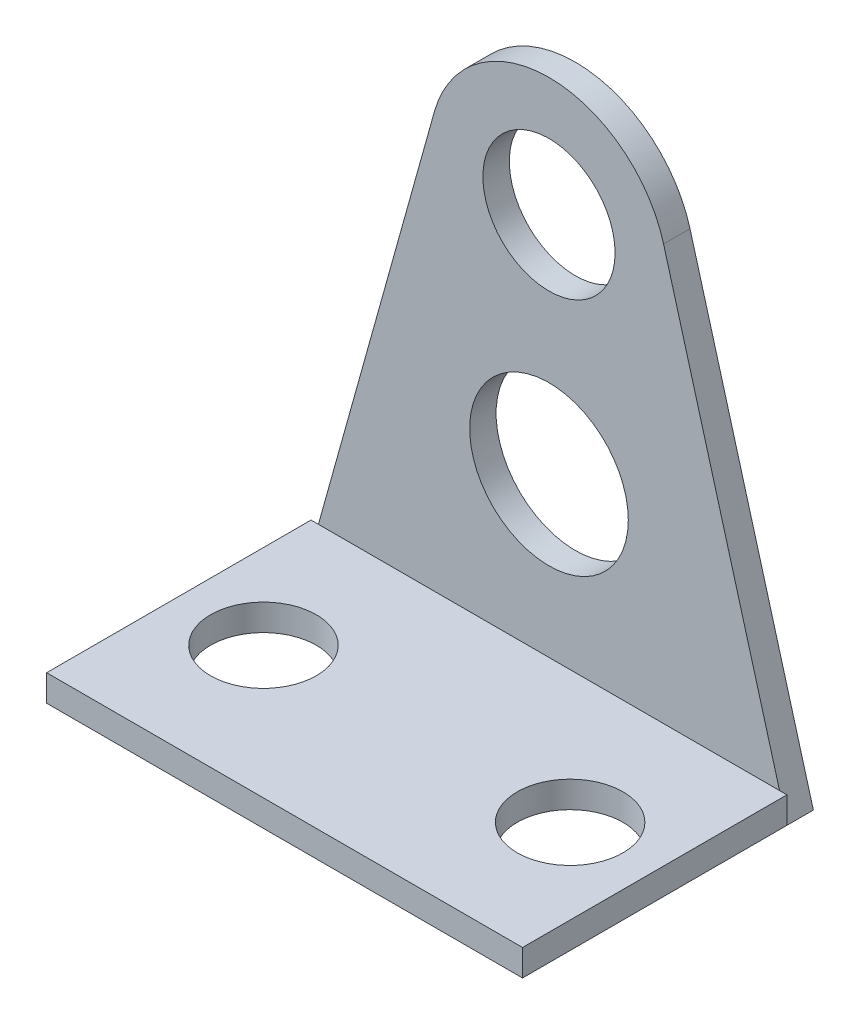
from build123d import *

# Parameters (mm, degrees)
SKETCH_1_R          = 1.25
SKETCH_1_R_2        = 1.5
EXTRUDE_1_DEPTH     = 0.5
SKETCH_2_W          = 9
SKETCH_2_H          = 0.5
EXTRUDE_2_DEPTH     = 5
CUT_EXTRUDE_1_REACH = 16.195
SKETCH_3_R          = 1


with BuildPart() as part:
    # 草图1 → 凸台-拉伸1 (new body)
    with BuildSketch(Plane.XY):
        with BuildLine():
            Line((0, 0), (9, 0))
            Line((9, 0), (6.667108595, 8.355095313))
            ThreePointArc((6.667108595, 8.355095313), (4.5, 10), (2.332891405, 8.355095313))
            Line((2.332891405, 8.355095313), (0, 0))
        make_face()
        with Locations((4.5, 7.75)):
            Circle(SKETCH_1_R, mode=Mode.SUBTRACT)
        with Locations((4.5, 3.5)):
            Circle(SKETCH_1_R_2, mode=Mode.SUBTRACT)
    extrude(amount=EXTRUDE_1_DEPTH)

    # 草图2 → 凸台-拉伸2 (add)
    with BuildSketch(Plane.XY.offset(0.5)):
        with Locations((4.5, 0.25)):
            Rectangle(SKETCH_2_W, SKETCH_2_H)
    extrude(amount=EXTRUDE_2_DEPTH)

    # 草图3 → 切除-拉伸1 (cut, up to next)
    with BuildSketch(Plane(origin=(0, 0.5, 0), x_dir=(1, 0, 0), z_dir=(0, 1, 0)), mode=Mode.PRIVATE) as cut_extrude_1_sk1:
        with Locations(Location((1.6, -3, 0), (0, 0, 270))):
            Circle(SKETCH_3_R)
    cut_extrude_1_tool1 = extrude(cut_extrude_1_sk1.sketch, amount=-CUT_EXTRUDE_1_REACH, mode=Mode.PRIVATE) & part.part
    # 草图3 → 切除-拉伸1 (cut, up to next)
    with BuildSketch(Plane(origin=(0, 0.5, 0), x_dir=(1, 0, 0), z_dir=(0, 1, 0)), mode=Mode.PRIVATE) as cut_extrude_1_sk2:
        with Locations(Location((7.4, -3, 0), (0, 0, 270))):
            Circle(SKETCH_3_R)
    cut_extrude_1_tool2 = extrude(cut_extrude_1_sk2.sketch, amount=-CUT_EXTRUDE_1_REACH, mode=Mode.PRIVATE) & part.part
    add(cut_extrude_1_tool1.solids().sort_by_distance((1.6, 0.5, 3))[0], mode=Mode.SUBTRACT)
    add(cut_extrude_1_tool2.solids().sort_by_distance((7.4, 0.5, 3))[0], mode=Mode.SUBTRACT)


solid = part.part
